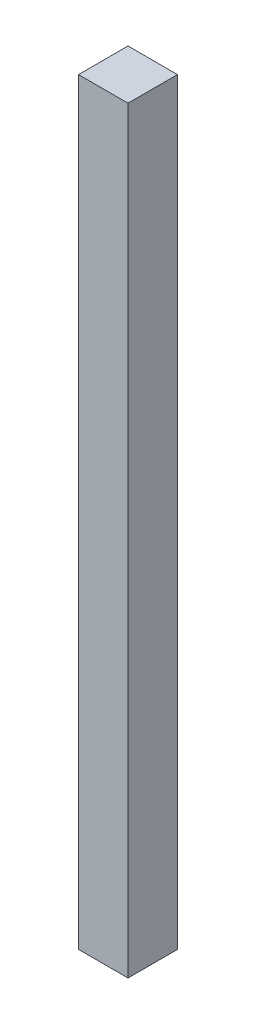
from build123d import *

# Parameters (mm, degrees)
SKETCH4_W           = 20
SKETCH4_H           = 20
BOSS_EXTRUDE2_DEPTH = 306


with BuildPart() as part:
    # Sketch4 → Boss-Extrude2 (new body)
    with BuildSketch(Plane(origin=(0, 0, 0), x_dir=(1, 0, 0), z_dir=(0, 1, 0))):
        with Locations((10, 10)):
            Rectangle(SKETCH4_W, SKETCH4_H)
    extrude(amount=BOSS_EXTRUDE2_DEPTH)


solid = part.part
